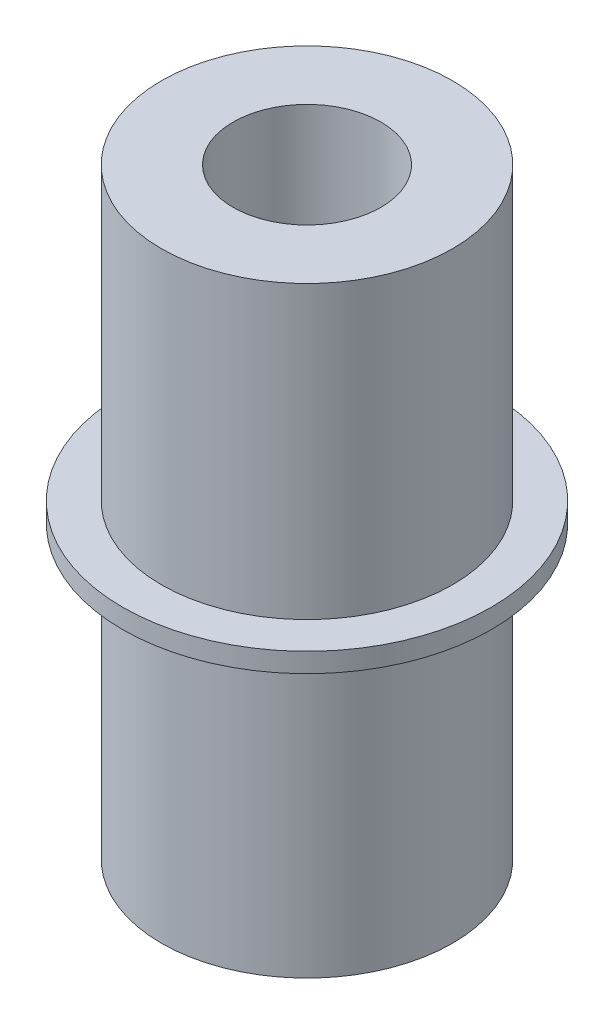
from build123d import *


with BuildPart() as part:
    # Sketch1 → Revolve1 (revolve)
    with BuildSketch(Plane.XY, mode=Mode.PRIVATE) as revolve1_sk:
        Polygon((-3.81, -15.5), (-3.81, 15.5), (-7.5, 15.5), (-7.5, 0.5), (-9.5, 0.5), (-9.5, -0.5), (-7.5, -0.5), (-7.5, -15.5), align=None)
    revolve(revolve1_sk.sketch.rotate(Axis((0, 0, 0), (0, 1, 0)), 270), axis=Axis((0, 0, 0), (0, 1, 0)))


solid = part.part
